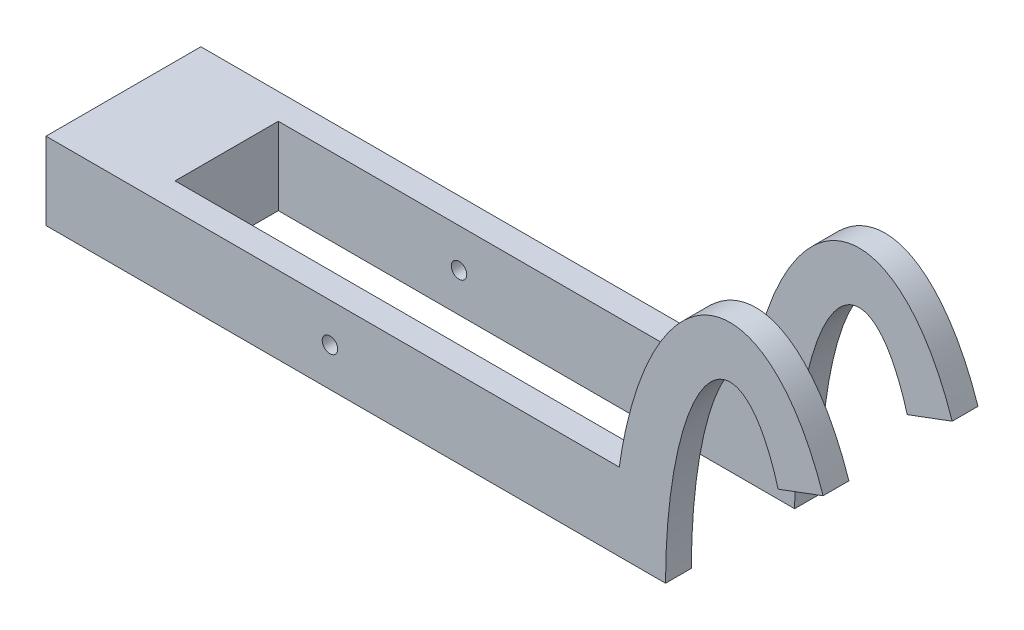
from build123d import *

# Parameters (mm, degrees)
BOSS_EXTRUDE1_DEPTH = 38.1
SKETCH2_W           = 260.312588867
SKETCH2_H           = 25.4
CUT_EXTRUDE1_DEPTH  = 206.003825783
SKETCH3_R           = 1.905
CUT_EXTRUDE2_DEPTH  = 206.003825783


with BuildPart() as part:
    # Sketch1 → Boss-Extrude1 (new body)
    with BuildSketch(Plane.XY):
        with BuildLine():
            Line((0, 0), (0, 19.05))
            Line((0, 19.05), (141.01618732, 19.05))
            add(Edge.make_bspline(
                [(191.161472393, 38.021436866), (157.754291932, 137.325067756), (141.01618732, 19.05)],
                knots=[5.354344466, 5.354344466, 5.354344466, 7.54928898, 7.54928898, 7.54928898], degree=2, weights=[1, 0.455847413, 1]))
            Line((191.161472393, 38.021436866), (180.098192457, 33.90003112))
            add(Edge.make_bspline(
                [(180.098192457, 33.90003112), (152.4, 132.820472934), (152.4, 0)],
                knots=[5.442998148, 5.442998148, 5.442998148, 7.853981634, 7.853981634, 7.853981634], degree=2, weights=[1, 0.357233797, 1]))
            Line((152.4, 0), (0, 0))
        make_face()
    extrude(amount=BOSS_EXTRUDE1_DEPTH)

    # Sketch2 → Cut-Extrude1 (cut, through all)
    with BuildSketch(Plane.XZ):
        with Locations((155.556294433, 19.05)):
            Rectangle(SKETCH2_W, SKETCH2_H)
    extrude(amount=-CUT_EXTRUDE1_DEPTH, mode=Mode.SUBTRACT)

    # Sketch3 → Cut-Extrude2 (cut, through all)
    with BuildSketch(Plane.XY.offset(38.1)):
        with Locations((69.85, 9.525)):
            Circle(SKETCH3_R)
    extrude(amount=-CUT_EXTRUDE2_DEPTH, mode=Mode.SUBTRACT)


solid = part.part
